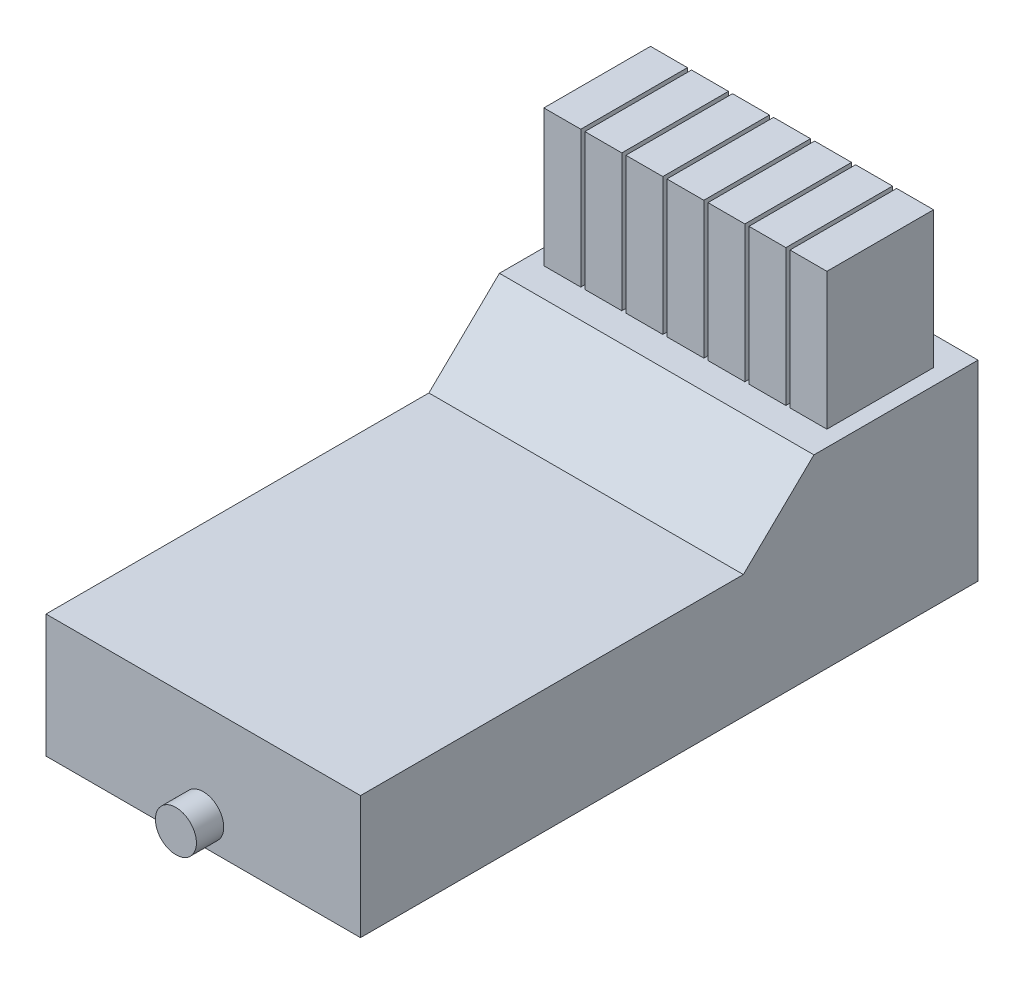
from build123d import *

# Parameters (mm, degrees)
BOSS_EXTRUDE1_DEPTH = 23
SKETCH2_R           = 1.5
BOSS_EXTRUDE2_DEPTH = 2
SKETCH3_W           = 2.7
SKETCH3_H           = 7.8
BOSS_EXTRUDE3_DEPTH = 10


with BuildPart() as part:
    # Sketch1 → Boss-Extrude1 (new body)
    with BuildSketch(Plane(origin=(0, 0, 0), x_dir=(0, 0, -1), z_dir=(1, 0, 0))):
        Polygon((0, 0), (0, 9), (28, 9), (33.16, 14), (45.16, 14), (45.16, 0), align=None)
    extrude(amount=BOSS_EXTRUDE1_DEPTH)

    # Sketch2 → Boss-Extrude2 (add)
    with BuildSketch(Plane.XY):
        with Locations(Location((11.5, 2, 0), (0, 0, 180))):
            Circle(SKETCH2_R)
    extrude(amount=BOSS_EXTRUDE2_DEPTH)

    # Sketch3 → Boss-Extrude3 (add)
    with BuildSketch(Plane(origin=(0, 14, 0), x_dir=(1, 0, 0), z_dir=(0, 1, 0))):
        with Locations((14.5, 39.16)):
            Rectangle(SKETCH3_W, SKETCH3_H)
        with Locations((11.5, 39.16)):
            Rectangle(SKETCH3_W, SKETCH3_H)
        with Locations((17.5, 39.16)):
            Rectangle(SKETCH3_W, SKETCH3_H)
        with Locations((20.5, 39.16)):
            Rectangle(SKETCH3_W, SKETCH3_H)
        with Locations((8.5, 39.16)):
            Rectangle(SKETCH3_W, SKETCH3_H)
        with Locations((5.5, 39.16)):
            Rectangle(SKETCH3_W, SKETCH3_H)
        with Locations((2.5, 39.16)):
            Rectangle(SKETCH3_W, SKETCH3_H)
    extrude(amount=BOSS_EXTRUDE3_DEPTH)


solid = part.part
